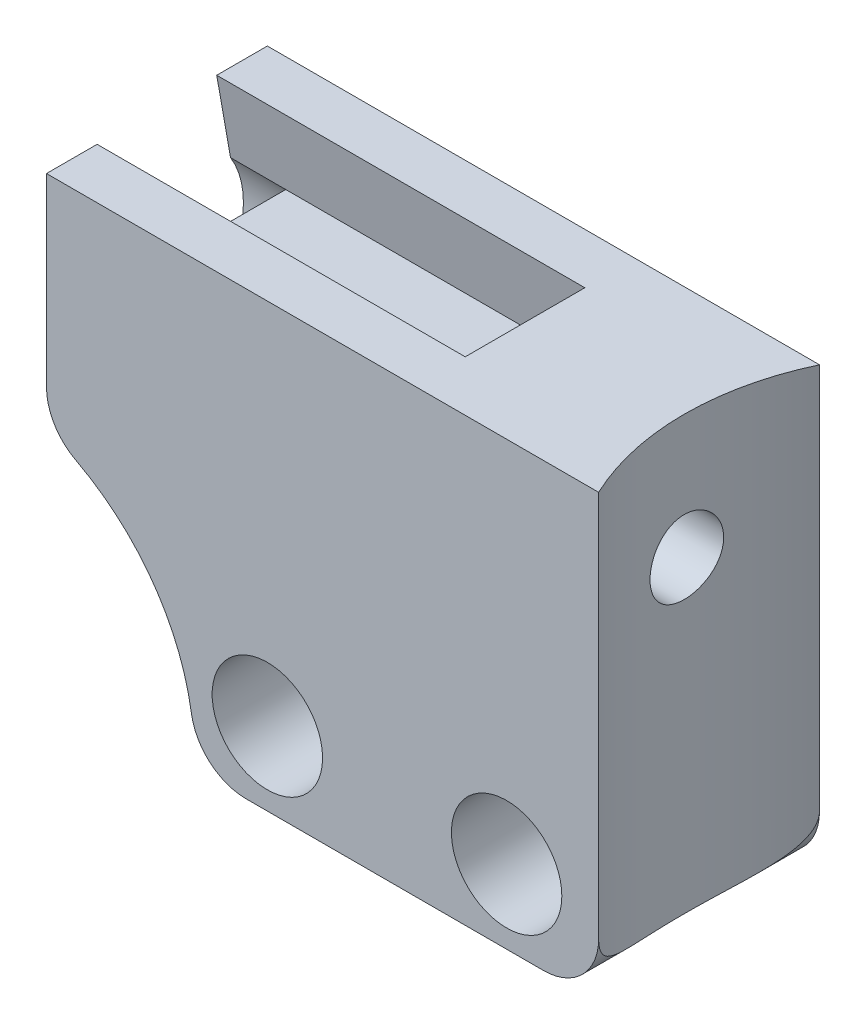
from build123d import *

# Parameters (mm, degrees)
SKETCH_1_R               = 3
EXTRUDE_1_DEPTH          = 6
SKETCH_2_R               = 2
CUT_EXTRUDE_1_DEPTH      = 39.88444419
CUT_EXTRUDE_3_DEPTH      = 20
SKETCH_2_5_R             = 2
CUT_EXTRUDE_4_DEPTH      = 3
CUT_EXTRUDE_5_DEPTH      = 39.884444283
CUT_EXTRUDE_5_DEPTH_BACK = 39.884444283


with BuildPart() as part:
    # 草图1 → 凸台-拉伸1 (new, symmetric)
    with BuildSketch(Plane.XY):
        with BuildLine():
            Line((-19.161323267, 0), (-3, 0))
            ThreePointArc((-3, 0), (-0.878679656, 0.878679656), (0, 3))
            Line((0, 3), (0, 24))
            Line((0, 24), (-30, 24))
            Line((-30, 24), (-30, 13.956143181))
            ThreePointArc((-30, 13.956143181), (-29.567922082, 12.405086708), (-28.396149212, 11.30081507))
            ThreePointArc((-28.396149212, 11.30081507), (-24.221365462, 7.661944199), (-22.125207826, 2.535900525))
            ThreePointArc((-22.125207826, 2.535900525), (-21.111669593, 0.720493647), (-19.161323267, 0))
        make_face()
        with Locations((-18, 4)):
            Circle(SKETCH_1_R, mode=Mode.SUBTRACT)
        with Locations((-5, 4)):
            Circle(SKETCH_1_R, mode=Mode.SUBTRACT)
    extrude(amount=EXTRUDE_1_DEPTH, both=True)

    # 草图2 → 切除-拉伸1 (cut, through all)
    with BuildSketch(Plane.ZY.offset(30)):
        with Locations((0, 17.278746099)):
            Circle(SKETCH_2_R)
    extrude(amount=-CUT_EXTRUDE_1_DEPTH, mode=Mode.SUBTRACT)

    # 草图2<4> → 切除-拉伸3 (cut)
    with BuildSketch(Plane.ZY.offset(30)):
        Polygon((-3.25, 24), (-4, 19.746538635), (4, 19.746538635), (3.25, 24), align=None)
    extrude(amount=-CUT_EXTRUDE_3_DEPTH, mode=Mode.SUBTRACT)

    # 草图2<5> → 切除-拉伸4 (cut)
    with BuildSketch(Plane.ZY.offset(30)):
        with BuildLine():
            Line((4, 19.746538635), (-4, 19.746538635))
            ThreePointArc((-4, 19.746538635), (0, 12.578746099), (4, 19.746538635))
        make_face()
        with Locations((0, 17.278746099)):
            Circle(SKETCH_2_5_R, mode=Mode.SUBTRACT)
    extrude(amount=-CUT_EXTRUDE_4_DEPTH, mode=Mode.SUBTRACT)

    # 草图3 → 切除-拉伸5 (cut, two sides: drawn at the far end of the back side and taken through both)
    with BuildSketch(Plane(origin=(0, 24, 0), x_dir=(1, 0, 0), z_dir=(0, 1, 0)).offset(-CUT_EXTRUDE_5_DEPTH_BACK)):
        with BuildLine():
            Line((31.980847691, 73.421546804), (0, 6))
            ThreePointArc((0, 6), (-1.350889359, 0), (0, -6))
            Line((0, -6), (31.980847691, -73.421546804))
            Line((31.980847691, -73.421546804), (181.224803582, -73.421546804))
            Line((181.224803582, -73.421546804), (181.224803582, 73.421546804))
            Line((181.224803582, 73.421546804), (31.980847691, 73.421546804))
        make_face()
    extrude(amount=CUT_EXTRUDE_5_DEPTH + CUT_EXTRUDE_5_DEPTH_BACK, mode=Mode.SUBTRACT)


solid = part.part
